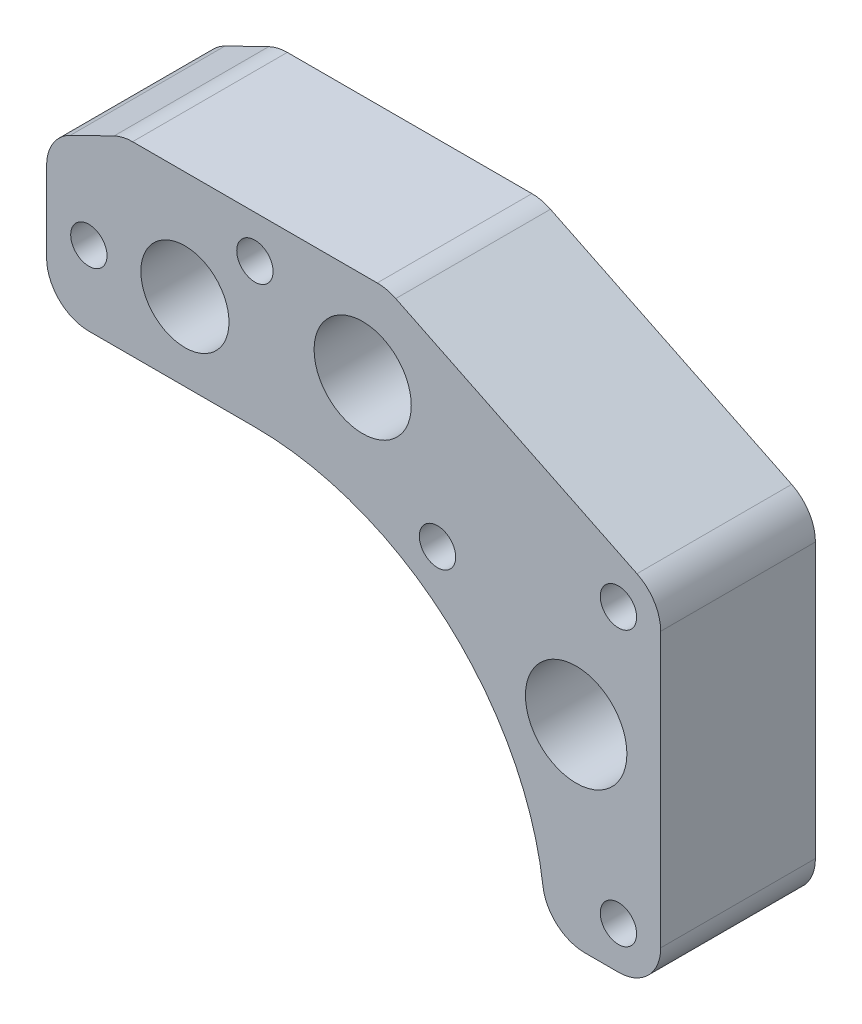
from build123d import *

# Parameters (mm, degrees)
SKETCH_1_R           = 6
EXTRUDE_1_DEPTH      = 18.3
CUT_EXTRUDE_1_DEPTH  = 18.3
CUT_EXTRUDE_2_DEPTH  = 18.3
CUT_EXTRUDE_3_DEPTH  = 18.3
FILLET_1_R           = 2
CUT_EXTRUDE_4_DEPTH  = 18.3
CUT_EXTRUDE_5_DEPTH  = 18.3
CUT_EXTRUDE_6_DEPTH  = 60
CUT_EXTRUDE_8_DEPTH  = 104
SKETCH_10_R          = 2.15
CUT_EXTRUDE_9_DEPTH  = 144
FILLET_2_R           = 5
SKETCH_13_R          = 6
SKETCH_13_R_2        = 5.747449745
SKETCH_13_R_3        = 5.213004259
CUT_EXTRUDE_11_DEPTH = 70


with BuildPart() as part:
    # 草图1 → 凸台-拉伸1 (new body)
    with BuildSketch(Plane.XY):
        with BuildLine():
            Line((-56, 0), (-34.35, 0))
            ThreePointArc((-34.35, 0), (0, 34.35), (34.35, 0))
            Line((34.35, 0), (56, 0))
            Line((56, 0), (56, 56.65))
            Line((56, 56.65), (8.281928864, 111.239451243))
            ThreePointArc((8.281928864, 111.239451243), (0, 115), (-8.281928864, 111.239451243))
            Line((-8.281928864, 111.239451243), (-56, 56.65))
            Line((-56, 56.65), (-56, 0))
        make_face()
        with Locations((0, 104)):
            Circle(SKETCH_1_R, mode=Mode.SUBTRACT)
    extrude(amount=EXTRUDE_1_DEPTH)

    # 草图2 → 切除-拉伸1 (cut)
    with BuildSketch(Plane(origin=(0, 0, 0), x_dir=(-1, 0, 0), z_dir=(0, 0, -1))):
        with BuildLine():
            Line((56, 34.35), (0, 34.35))
            ThreePointArc((0, 34.35), (24.289117934, 24.289117934), (34.35, 0))
            Line((34.35, 0), (56, 0))
            Line((56, 0), (56, 34.35))
        make_face()
    extrude(amount=-CUT_EXTRUDE_1_DEPTH, mode=Mode.SUBTRACT)

    # 草图3 → 切除-拉伸2 (cut)
    with BuildSketch(Plane(origin=(0, 0, 0), x_dir=(-1, 0, 0), z_dir=(0, 0, -1))):
        Polygon((41, 34.35), (41, 59.35), (9.317845696, 109.846174099), (56, 56.65), (56, 34.35), align=None)
    extrude(amount=-CUT_EXTRUDE_2_DEPTH, mode=Mode.SUBTRACT)

    # 草图4 → 切除-拉伸3 (cut)
    with BuildSketch(Plane.XY.offset(18.3)):
        Polygon((-9.317845696, 109.846174099), (-8.855036315, 110.583816584), (-56, 56.65), align=None)
    extrude(amount=-CUT_EXTRUDE_3_DEPTH, mode=Mode.SUBTRACT)

    # 圆角1
    fillet_1_edges = [part.edges().sort_by_distance(p)[0] for p in [
        (-41, 34.35, 9.15),
    ]]
    fillet(fillet_1_edges, radius=FILLET_1_R)

    # 草图5 → 切除-拉伸4 (cut)
    with BuildSketch(Plane(origin=(0, 0, 0), x_dir=(-1, 0, 0), z_dir=(0, 0, -1))):
        Polygon((24.641777725, 34.35), (24.641777725, 85.422331825), (54.641777725, 59.35), (54.641777725, 34.35), align=None)
    extrude(amount=-CUT_EXTRUDE_4_DEPTH, mode=Mode.SUBTRACT)

    # 草图6 → 切除-拉伸5 (cut)
    with BuildSketch(Plane.XY.offset(18.3)):
        Polygon((-24.641777725, 56.346305337), (15.622574059, 56.346305337), (54.315270896, 37.471819075), (54.315270896, 119.471819075), (-24.641777725, 119.471819075), align=None)
    extrude(amount=-CUT_EXTRUDE_5_DEPTH, mode=Mode.SUBTRACT)

    # 草图7 → 切除-拉伸6 (cut)
    with BuildSketch(Plane.XY.offset(18.3)):
        Polygon((-15.622574059, 56.346305337), (-24.641777725, 51.946693793), (-24.641777725, 56.346305337), align=None)
    extrude(amount=-CUT_EXTRUDE_6_DEPTH, mode=Mode.SUBTRACT)

    # 草图9 → 切除-拉伸8 (cut)
    with BuildSketch(Plane.XY.offset(18.3)):
        Polygon((48, 0), (48, 40.552439024), (56, 36.65), (56, 0), align=None)
    extrude(amount=-CUT_EXTRUDE_8_DEPTH, mode=Mode.SUBTRACT)


with BuildPart() as cut_extrude_8_piece_1:
    # of the separate pieces the step leaves, piece 1, a body of its own (cut_extrude_8_pieces)
    add(part.part.solids().sort_by_distance((-24.641777725, 34.35, 0))[0])

    # 草图10 → 切除-拉伸9 (cut)
    with BuildSketch(Plane(origin=(0, 0, 0), x_dir=(-1, 0, 0), z_dir=(0, 0, -1))):
        with Locations((-43, 5)):
            Circle(SKETCH_10_R)
        with Locations((-43, 37.428295255)):
            Circle(SKETCH_10_R)
        with Locations((0, 51.346305337)):
            Circle(SKETCH_10_R)
        with Locations((19.641777725, 43.148346896)):
            Circle(SKETCH_10_R)
        with Locations((-21.597406613, 32.893381213)):
            Circle(SKETCH_10_R)
    extrude(amount=-CUT_EXTRUDE_9_DEPTH, mode=Mode.SUBTRACT)

    # 圆角2
    fillet_2_edges = [cut_extrude_8_piece_1.edges().sort_by_distance(p)[0] for p in [
        (48, 0, 9.15),
        (34.35, 0, 9.15),
        (-24.641777725, 34.35, 9.15),
        (48, 40.552439024, 9.15),
        (15.622574059, 56.346305337, 9.15),
        (-15.622574059, 56.346305337, 9.15),
        (-24.641777725, 51.946693793, 9.15),
    ]]
    fillet(fillet_2_edges, radius=FILLET_2_R)

    # 草图13 → 切除-拉伸11 (cut)
    with BuildSketch(Plane(origin=(0, 0, 0), x_dir=(-1, 0, 0), z_dir=(0, 0, -1))):
        with Locations((-38, 22.86749877)):
            Circle(SKETCH_13_R)
        with Locations((-12.747449745, 45.790830958)):
            Circle(SKETCH_13_R_2)
        with Locations((8.278773466, 43.563004259)):
            Circle(SKETCH_13_R_3)
    extrude(amount=-CUT_EXTRUDE_11_DEPTH, mode=Mode.SUBTRACT)


with BuildPart() as cut_extrude_8_piece_2:
    # of the separate pieces the step leaves, piece 2, a body of its own (cut_extrude_8_pieces)
    add(part.part.solids().sort_by_distance((54.315270896, 37.471819075, 0))[0])


solid = cut_extrude_8_piece_1.part
